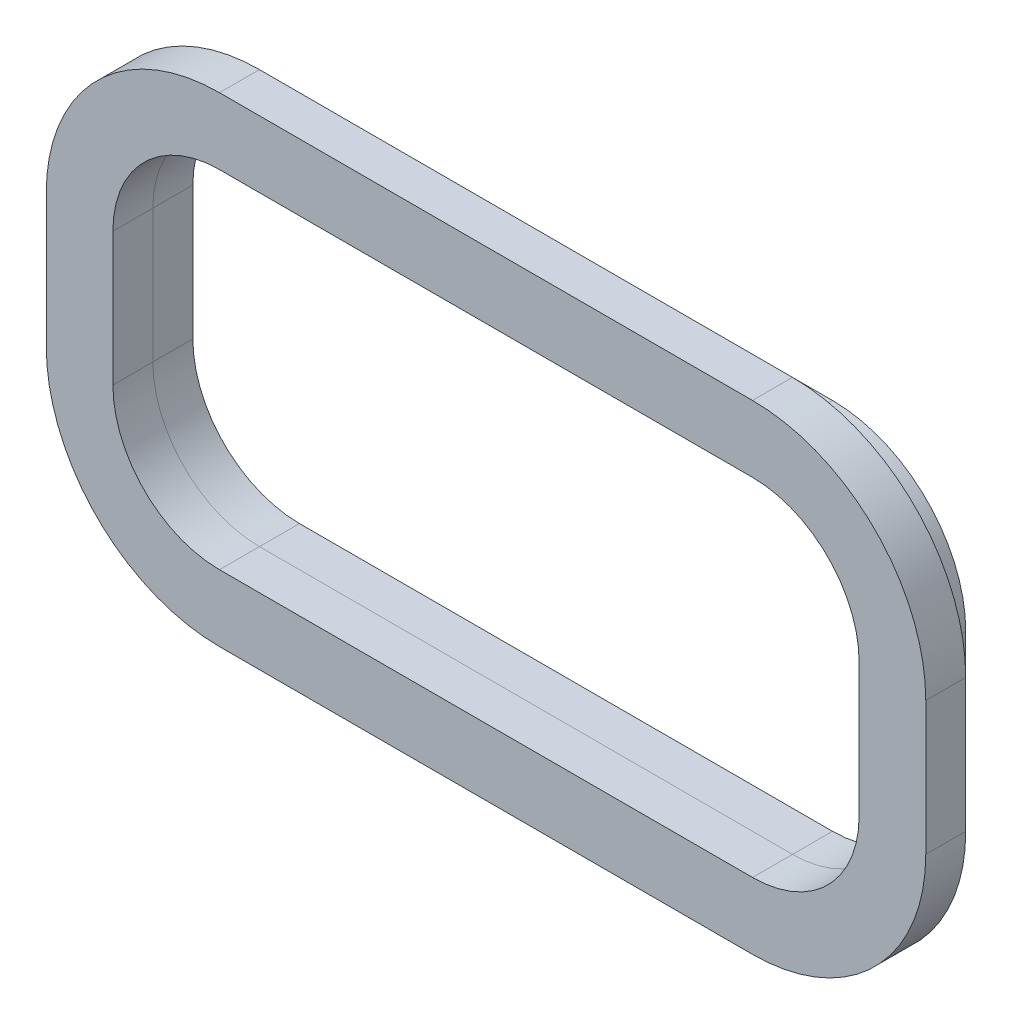
from build123d import *

# Parameters (mm, degrees)
BOSS_EXTRU_1_DEPTH      = 3
BOSS_EXTRU_2_DEPTH      = 3
ENL_V_MAT_EXTRU_1_DEPTH = 40.045647227


with BuildPart() as part:
    # Esquisse2 → Boss.-Extru.1 (new body)
    with BuildSketch(Plane.XY):
        with BuildLine():
            Line((28.678345257, -4.626470588), (28.678345257, 5.373529412))
            ThreePointArc((28.678345257, 5.373529412), (25.749413069, 12.444597224), (18.678345257, 15.373529412))
            Line((18.678345257, 15.373529412), (-21.321654743, 15.373529412))
            ThreePointArc((-21.321654743, 15.373529412), (-28.392722555, 12.444597224), (-31.321654743, 5.373529412))
            Line((-31.321654743, 5.373529412), (-31.321654743, -4.626470588))
            ThreePointArc((-31.321654743, -4.626470588), (-28.392722555, -11.6975384), (-21.321654743, -14.626470588))
            Line((-21.321654743, -14.626470588), (18.678345257, -14.626470588))
            ThreePointArc((18.678345257, -14.626470588), (25.749413069, -11.6975384), (28.678345257, -4.626470588))
        make_face()
        with BuildLine():
            Line((26.678345257, -4.626470588), (26.678345257, 5.373529412))
            ThreePointArc((26.678345257, 5.373529412), (24.335199507, 11.030383661), (18.678345257, 13.373529412))
            Line((18.678345257, 13.373529412), (-21.321654743, 13.373529412))
            ThreePointArc((-21.321654743, 13.373529412), (-26.978508992, 11.030383661), (-29.321654743, 5.373529412))
            Line((-29.321654743, 5.373529412), (-29.321654743, -4.626470588))
            ThreePointArc((-29.321654743, -4.626470588), (-26.978508992, -10.283324838), (-21.321654743, -12.626470588))
            Line((-21.321654743, -12.626470588), (18.678345257, -12.626470588))
            ThreePointArc((18.678345257, -12.626470588), (24.335199507, -10.283324838), (26.678345257, -4.626470588))
        make_face(mode=Mode.SUBTRACT)
    extrude(amount=BOSS_EXTRU_1_DEPTH)


with BuildPart() as body_2:
    # Esquisse3 → Boss.-Extru.2 (new body)
    # profile 1 of 3: a face of its own
    with BuildSketch(Plane.XY.offset(3)):
        with BuildLine():
            Line((-21.321654743, -17.626470588), (18.678345257, -17.626470588))
            ThreePointArc((18.678345257, -17.626470588), (27.870733412, -13.818858744), (31.678345257, -4.626470588))
            Line((31.678345257, -4.626470588), (31.678345257, 5.373529412))
            ThreePointArc((31.678345257, 5.373529412), (27.870733412, 14.565917567), (18.678345257, 18.373529412))
            Line((18.678345257, 18.373529412), (-21.321654743, 18.373529412))
            ThreePointArc((-21.321654743, 18.373529412), (-30.514042898, 14.565917567), (-34.321654743, 5.373529412))
            Line((-34.321654743, 5.373529412), (-34.321654743, -4.626470588))
            ThreePointArc((-34.321654743, -4.626470588), (-30.514042898, -13.818858744), (-21.321654743, -17.626470588))
        make_face()
        with BuildLine():
            ThreePointArc((28.678345257, 5.373529412), (25.749413069, 12.444597224), (18.678345257, 15.373529412))
            Line((18.678345257, 15.373529412), (-21.321654743, 15.373529412))
            ThreePointArc((-21.321654743, 15.373529412), (-28.392722555, 12.444597224), (-31.321654743, 5.373529412))
            Line((-31.321654743, 5.373529412), (-31.321654743, -4.626470588))
            ThreePointArc((-31.321654743, -4.626470588), (-28.392722555, -11.6975384), (-21.321654743, -14.626470588))
            Line((-21.321654743, -14.626470588), (18.678345257, -14.626470588))
            ThreePointArc((18.678345257, -14.626470588), (25.749413069, -11.6975384), (28.678345257, -4.626470588))
            Line((28.678345257, -4.626470588), (28.678345257, 5.373529412))
        make_face(mode=Mode.SUBTRACT)
    # profile 2 of 3: a face of its own
    with BuildSketch(Plane.XY.offset(3)):
        with BuildLine():
            Line((28.678345257, -4.626470588), (28.678345257, 5.373529412))
            ThreePointArc((28.678345257, 5.373529412), (25.749413069, 12.444597224), (18.678345257, 15.373529412))
            Line((18.678345257, 15.373529412), (-21.321654743, 15.373529412))
            ThreePointArc((-21.321654743, 15.373529412), (-28.392722555, 12.444597224), (-31.321654743, 5.373529412))
            Line((-31.321654743, 5.373529412), (-31.321654743, -4.626470588))
            ThreePointArc((-31.321654743, -4.626470588), (-28.392722555, -11.6975384), (-21.321654743, -14.626470588))
            Line((-21.321654743, -14.626470588), (18.678345257, -14.626470588))
            ThreePointArc((18.678345257, -14.626470588), (25.749413069, -11.6975384), (28.678345257, -4.626470588))
        make_face()
        with BuildLine():
            ThreePointArc((18.678345257, 13.373529412), (24.335199507, 11.030383661), (26.678345257, 5.373529412))
            Line((26.678345257, 5.373529412), (26.678345257, -4.626470588))
            ThreePointArc((26.678345257, -4.626470588), (24.335199507, -10.283324838), (18.678345257, -12.626470588))
            Line((18.678345257, -12.626470588), (-21.321654743, -12.626470588))
            ThreePointArc((-21.321654743, -12.626470588), (-26.978508992, -10.283324838), (-29.321654743, -4.626470588))
            Line((-29.321654743, -4.626470588), (-29.321654743, 5.373529412))
            ThreePointArc((-29.321654743, 5.373529412), (-26.978508992, 11.030383661), (-21.321654743, 13.373529412))
            Line((-21.321654743, 13.373529412), (18.678345257, 13.373529412))
        make_face(mode=Mode.SUBTRACT)
    # profile 3 of 3: a face of its own
    with BuildSketch(Plane.XY.offset(3)):
        with BuildLine():
            Line((26.678345257, 5.373529412), (26.678345257, -4.626470588))
            ThreePointArc((26.678345257, -4.626470588), (24.335199507, -10.283324838), (18.678345257, -12.626470588))
            Line((18.678345257, -12.626470588), (-21.321654743, -12.626470588))
            ThreePointArc((-21.321654743, -12.626470588), (-26.978508992, -10.283324838), (-29.321654743, -4.626470588))
            Line((-29.321654743, -4.626470588), (-29.321654743, 5.373529412))
            ThreePointArc((-29.321654743, 5.373529412), (-26.978508992, 11.030383661), (-21.321654743, 13.373529412))
            Line((-21.321654743, 13.373529412), (18.678345257, 13.373529412))
            ThreePointArc((18.678345257, 13.373529412), (24.335199507, 11.030383661), (26.678345257, 5.373529412))
        make_face()
    extrude(amount=BOSS_EXTRU_2_DEPTH)

    # Esquisse4 → Enlèv. mat.-Extru.1 (cut, through all)
    with BuildSketch(Plane(origin=(0, 0, 3), x_dir=(-1, 0, 0), z_dir=(0, 0, -1))):
        with BuildLine():
            Line((21.321654743, 13.373529412), (-18.678345257, 13.373529412))
            ThreePointArc((-18.678345257, 13.373529412), (-24.335199507, 11.030383661), (-26.678345257, 5.373529412))
            Line((-26.678345257, 5.373529412), (-26.678345257, -4.626470588))
            ThreePointArc((-26.678345257, -4.626470588), (-24.335199507, -10.283324838), (-18.678345257, -12.626470588))
            Line((-18.678345257, -12.626470588), (21.321654743, -12.626470588))
            ThreePointArc((21.321654743, -12.626470588), (26.978508992, -10.283324838), (29.321654743, -4.626470588))
            Line((29.321654743, -4.626470588), (29.321654743, 5.373529412))
            ThreePointArc((29.321654743, 5.373529412), (26.978508992, 11.030383661), (21.321654743, 13.373529412))
        make_face()
    extrude(amount=-ENL_V_MAT_EXTRU_1_DEPTH, mode=Mode.SUBTRACT)


solid = Compound([part.part, body_2.part])
